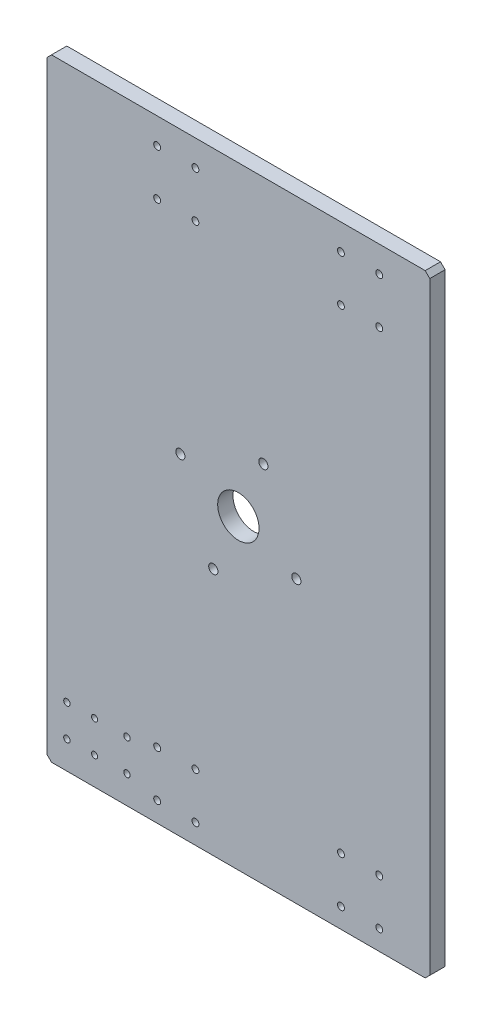
from build123d import *

# Parameters (mm, degrees)
ESQUISSE1_W                     = 250
ESQUISSE1_H                     = 400
BOSS_EXTRU_1_DEPTH              = 10
ESQUISSE2_R                     = 13.5
ENL_V_MAT_EXTRU_1_DEPTH         = 237.061432682
CHANFREIN1_SIZE                 = 3
TROU_TARAUD_M51_D               = 4.2
TROUS_DE_CENTRAGE_4_0MM2_D      = 4
TROUS_DE_CENTRAGE_6_0MM2_D      = 6
D_GAGEMENT_M41_D                = 4.5
R_P_TITION_LIN_AIRE1_COUNT      = 2
R_P_TITION_LIN_AIRE1_PITCH      = 120
R_P_TITION_LIN_AIRE1_COUNT_DIR2 = 2
R_P_TITION_LIN_AIRE1_PITCH_DIR2 = 340


with BuildPart() as part:
    # Esquisse1 → Boss.-Extru.1 (new body)
    with BuildSketch(Plane.XY):
        Rectangle(ESQUISSE1_W, ESQUISSE1_H)
    extrude(amount=BOSS_EXTRU_1_DEPTH)

    # Esquisse2 → Enlèv. mat.-Extru.1 (cut, through all)
    with BuildSketch(Plane(origin=(0, 0, 0), x_dir=(-1, 0, 0), z_dir=(0, 0, -1))):
        Circle(ESQUISSE2_R)
    extrude(amount=-ENL_V_MAT_EXTRU_1_DEPTH, mode=Mode.SUBTRACT)

    # Chanfrein1
    chanfrein1_edges = [part.edges().sort_by_distance(p)[0] for p in [
        (125, -200, 5),
        (-125, -200, 5),
        (-125, 200, 5),
        (125, 200, 5),
    ]]
    chamfer(chanfrein1_edges, length=CHANFREIN1_SIZE)

    # Trou taraudé M51 (through all)
    with Locations(Plane.XY.offset(10)):
        with Locations((-72.698486264, -161.07971462), (-72.698486264, -181.838730229), (-111.937151978, -181.838730229), (-111.937151978, -161.07971462)):
            Hole(TROU_TARAUD_M51_D / 2)

    # Trous de centrage Ø4.0mm2 (through all)
    with Locations(Plane.XY.offset(10)):
        with Locations((-93.86308218, -161.07971462), (-93.86308218, -181.838730229)):
            Hole(TROUS_DE_CENTRAGE_4_0MM2_D / 2)

    # Trous de centrage Ø6.0mm2 (through all)
    with Locations(Plane.XY.offset(10)):
        with Locations((16.357059687, 37.86831259), (37.86831259, -16.357059687), (-16.357059687, -37.86831259), (-37.86831259, 16.357059687)):
            Hole(TROUS_DE_CENTRAGE_6_0MM2_D / 2)

    # Dégagement M41 (through all)
    with Locations(Plane(origin=(0, 0, 0), x_dir=(-1, 0, 0), z_dir=(0, 0, -1))):
        with Locations((28, -187), (28, -157), (53, -157), (53, -187)):
            d_gagement_m41 = Hole(D_GAGEMENT_M41_D / 2)

    # Répétition linéaire1: D_gagement M41 2 × 2
    with Locations(*[(i * R_P_TITION_LIN_AIRE1_PITCH, j * R_P_TITION_LIN_AIRE1_PITCH_DIR2, 0) for i in range(R_P_TITION_LIN_AIRE1_COUNT) for j in range(R_P_TITION_LIN_AIRE1_COUNT_DIR2) if (i, j) != (0, 0)]):
        add(d_gagement_m41, mode=Mode.SUBTRACT)


solid = part.part
